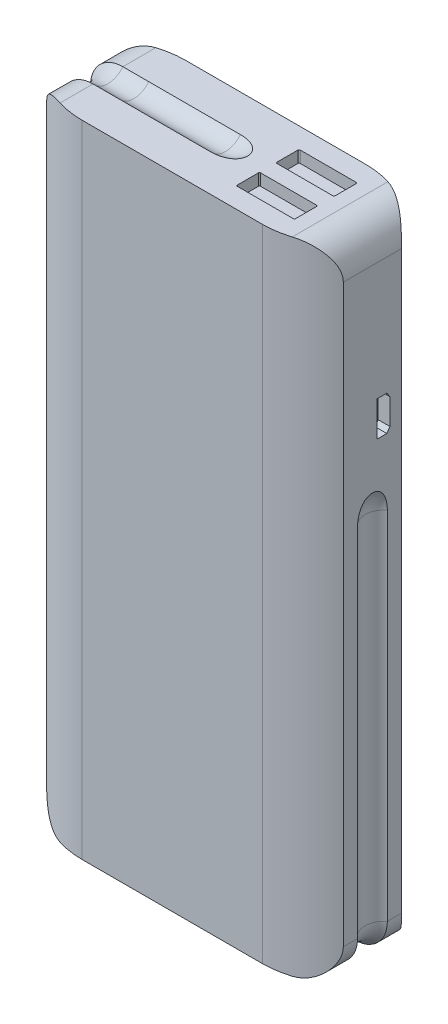
from build123d import *

# Parameters (mm, degrees)
BOSS_EXTRUDE1_DEPTH = 139.7
CUT_EXTRUDE1_DEPTH  = 146.175443726
CUT_EXTRUDE2_DEPTH  = 2.54
SKETCH5_R           = 4.1275
CUT_EXTRUDE3_DEPTH  = 2.54


with BuildPart() as part:
    # Sketch1 → Boss-Extrude1 (new body)
    with BuildSketch(Plane(origin=(0, 0, 0), x_dir=(1, 0, 0), z_dir=(0, 1, 0))):
        with BuildLine():
            ThreePointArc((-32.385, -6.35), (-26.500831002, -10.020938467), (-19.685, -11.303))
            Line((-19.685, -11.303), (19.685, -11.303))
            ThreePointArc((19.685, -11.303), (26.500831002, -10.020938467), (32.385, -6.35))
            Line((32.385, -6.35), (32.385, 6.35))
            ThreePointArc((32.385, 6.35), (26.500831002, 10.020938467), (19.685, 11.303))
            Line((19.685, 11.303), (-19.685, 11.303))
            ThreePointArc((-19.685, 11.303), (-26.500831002, 10.020938467), (-32.385, 6.35))
            Line((-32.385, 6.35), (-32.385, -6.35))
        make_face()
    extrude(amount=BOSS_EXTRUDE1_DEPTH)

    # Sketch2 → Cut-Extrude1 (cut, through all)
    with BuildSketch(Plane.XY.offset(11.303)):
        with BuildLine():
            Line((-32.385, 139.7), (-32.385, 132.6388))
            ThreePointArc((-32.385, 132.6388), (-30.316822403, 137.631822403), (-25.3238, 139.7))
            Line((-25.3238, 139.7), (-32.385, 139.7))
        make_face()
        with BuildLine():
            Line((32.385, 139.7), (25.3238, 139.7))
            ThreePointArc((25.3238, 139.7), (30.316822403, 137.631822403), (32.385, 132.6388))
            Line((32.385, 132.6388), (32.385, 139.7))
        make_face()
        with BuildLine():
            ThreePointArc((32.385, 7.0612), (30.316822403, 2.068177597), (25.3238, 0))
            Line((25.3238, 0), (32.385, 0))
            Line((32.385, 0), (32.385, 7.0612))
        make_face()
        with BuildLine():
            ThreePointArc((-25.3238, 0), (-30.316822403, 2.068177597), (-32.385, 7.0612))
            Line((-32.385, 7.0612), (-32.385, 0))
            Line((-32.385, 0), (-25.3238, 0))
        make_face()
    extrude(amount=-CUT_EXTRUDE1_DEPTH, mode=Mode.SUBTRACT)

    # Sketch4 → Cut-Extrude2 (cut)
    with BuildSketch(Plane(origin=(0, 139.7, 0), x_dir=(1, 0, 0), z_dir=(0, 1, 0))):
        with BuildLine():
            Line((21.971, -6.858), (9.779, -6.858))
            ThreePointArc((9.779, -6.858), (9.599394878, -6.783605122), (9.525, -6.604))
            Line((9.525, -6.604), (9.525, -2.032))
            ThreePointArc((9.525, -2.032), (9.599394878, -1.852394878), (9.779, -1.778))
            Line((9.779, -1.778), (21.971, -1.778))
            ThreePointArc((21.971, -1.778), (22.150605122, -1.852394878), (22.225, -2.032))
            Line((22.225, -2.032), (22.225, -6.604))
            ThreePointArc((22.225, -6.604), (22.150605122, -6.783605122), (21.971, -6.858))
        make_face()
        with BuildLine():
            Line((9.525, 6.604), (9.525, 2.032))
            ThreePointArc((9.525, 2.032), (9.599394878, 1.852394878), (9.779, 1.778))
            Line((9.779, 1.778), (21.971, 1.778))
            ThreePointArc((21.971, 1.778), (22.150605122, 1.852394878), (22.225, 2.032))
            Line((22.225, 2.032), (22.225, 6.604))
            ThreePointArc((22.225, 6.604), (22.150605122, 6.783605122), (21.971, 6.858))
            Line((21.971, 6.858), (9.779, 6.858))
            ThreePointArc((9.779, 6.858), (9.599394878, 6.783605122), (9.525, 6.604))
        make_face()
    extrude(amount=-CUT_EXTRUDE2_DEPTH, mode=Mode.SUBTRACT)

    # Cut-Sweep1: sweep along a path in Sketch3
    with BuildLine(Plane.XY) as cut_sweep1_path:
        Line((43.199496862, 88.9), (39.0525, 88.9))
        ThreePointArc((39.0525, 88.9), (36.133916761, 87.691083239), (34.925, 84.7725))
        Line((34.925, 84.7725), (34.925, 7.0612))
        ThreePointArc((34.925, 7.0612), (32.112873628, 0.272126372), (25.3238, -2.54))
        Line((25.3238, -2.54), (19.685, -2.54))
        Line((19.685, -2.54), (-19.685, -2.54))
        Line((-19.685, -2.54), (-25.3238, -2.54))
        ThreePointArc((-25.3238, -2.54), (-32.112873628, 0.272126372), (-34.925, 7.0612))
        Line((-34.925, 7.0612), (-34.925, 132.6388))
        ThreePointArc((-34.925, 132.6388), (-32.112873628, 139.427873628), (-25.3238, 142.24))
        Line((-25.3238, 142.24), (-19.685, 142.24))
        Line((-19.685, 142.24), (0.3175, 142.24))
        ThreePointArc((0.3175, 142.24), (3.236083239, 143.448916761), (4.445, 146.3675))
        Line((4.445, 146.3675), (4.445, 151.224135856))
    # Sketch5 → Cut-Sweep1 (sweep, cut)
    with BuildSketch(Plane(origin=(43.199496862, 0, 0), x_dir=(0, 0, -1), z_dir=(1, 0, 0))):
        with Locations((0, 88.9)):
            Circle(SKETCH5_R)
    sweep(path=cut_sweep1_path.line, mode=Mode.SUBTRACT)

    # Sketch6 → Cut-Extrude3 (cut)
    with BuildSketch(Plane(origin=(32.385, 0, 0), x_dir=(0, 0, -1), z_dir=(1, 0, 0))):
        Polygon((1.016, 99.30535623), (1.016, 106.92535623), (3.1369, 106.92535623), (3.81, 105.93475623), (3.81, 100.29595623), (3.1369, 99.30535623), align=None)
    extrude(amount=-CUT_EXTRUDE3_DEPTH, mode=Mode.SUBTRACT)


solid = part.part
